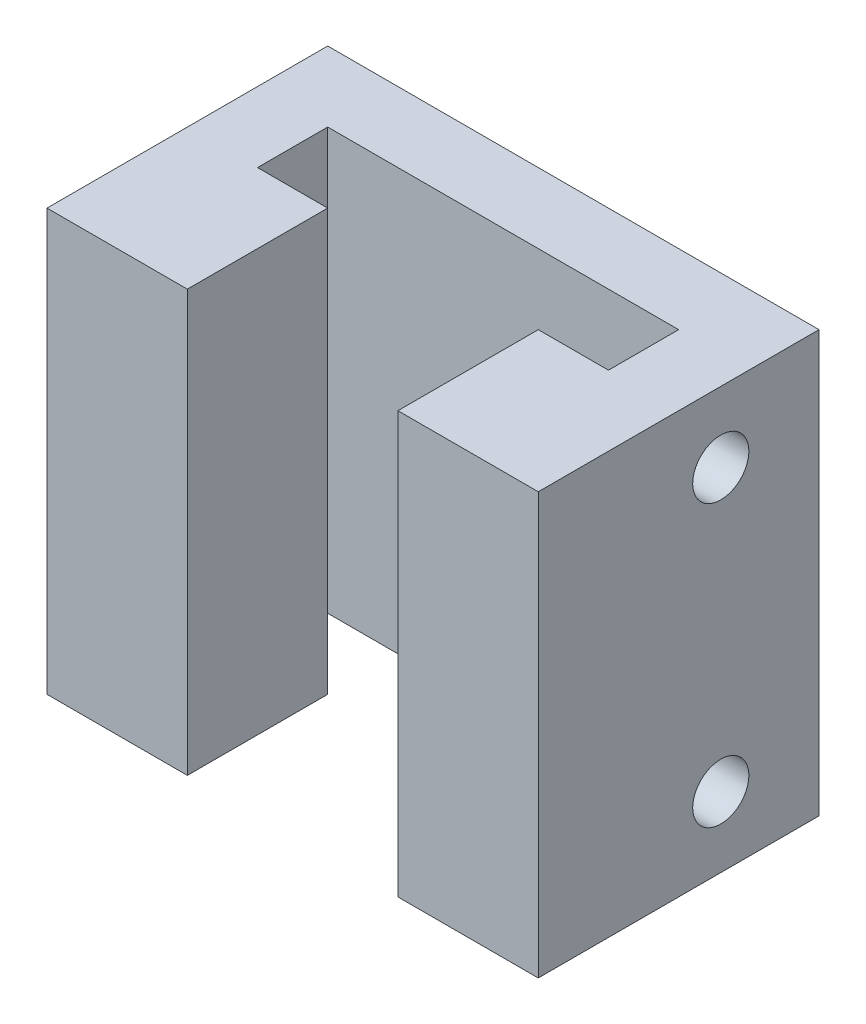
from build123d import *

# Parameters (mm, degrees)
BOSS_EXTRUDE1_DEPTH = 30
CUT_EXTRUDE1_START  = -35
SKETCH2_R           = 2
CUT_EXTRUDE1_DEPTH  = 3
CUT_EXTRUDE2_START  = -3
SKETCH3_R           = 2
CUT_EXTRUDE2_DEPTH  = 3


with BuildPart() as part:
    # Sketch1 → Boss-Extrude1 (new body)
    with BuildSketch(Plane(origin=(0, 0, 0), x_dir=(1, 0, 0), z_dir=(0, 1, 0))):
        Polygon((0, 0), (-10, 0), (-10, 20), (25, 20), (25, 0), (15, 0), (15, 10), (20, 10), (20, 15), (-5, 15), (-5, 10), (0, 10), align=None)
    extrude(amount=BOSS_EXTRUDE1_DEPTH)

    # Sketch2 → Cut-Extrude1 (cut)
    with BuildSketch(Plane.ZY.offset(10).offset(CUT_EXTRUDE1_START)):
        with Locations((-13, 25)):
            Circle(SKETCH2_R)
        with Locations((-13, 5)):
            Circle(SKETCH2_R)
    extrude(amount=CUT_EXTRUDE1_DEPTH, mode=Mode.SUBTRACT)

    # Sketch3 → Cut-Extrude2 (cut)
    with BuildSketch(Plane.ZY.offset(10).offset(CUT_EXTRUDE2_START)):
        with Locations((-13, 25)):
            Circle(SKETCH3_R)
        with Locations((-13, 5)):
            Circle(SKETCH3_R)
    extrude(amount=CUT_EXTRUDE2_DEPTH, mode=Mode.SUBTRACT)


solid = part.part
